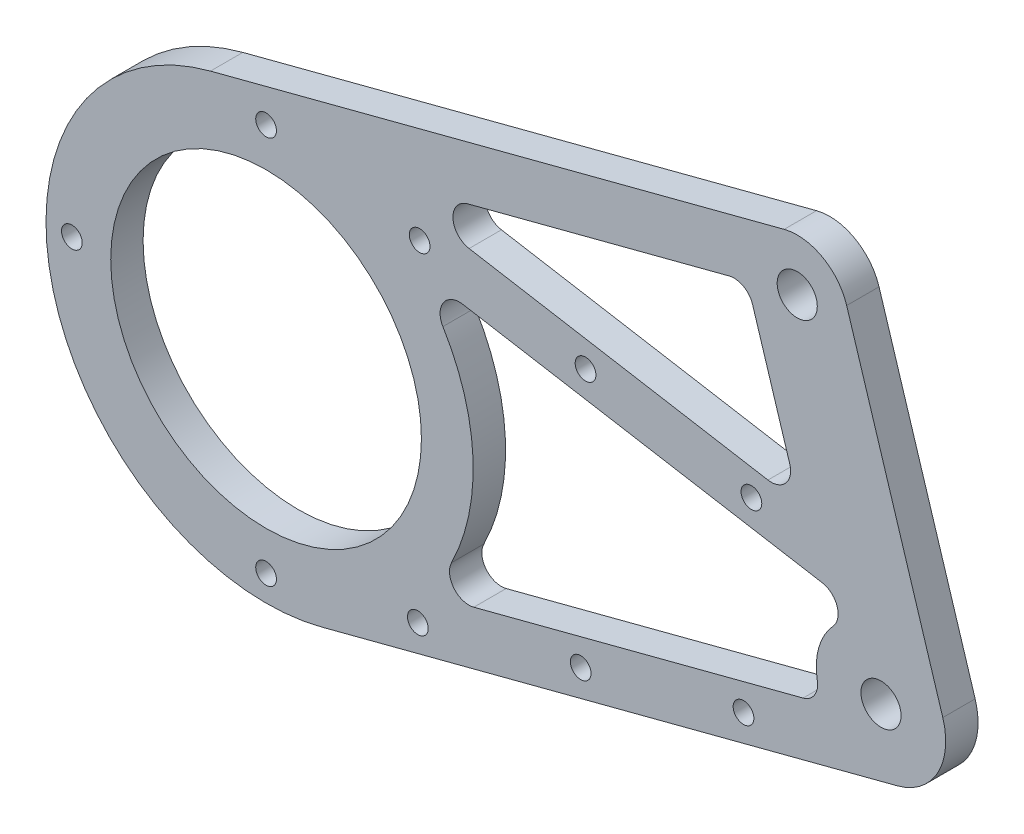
from build123d import *

# Parameters (mm, degrees)
SKETCH_1_R          = 3.1
SKETCH_1_R_2        = 24
EXTRUDE_1_DEPTH     = 5
SKETCH_2_R          = 1.6
CUT_EXTRUDE_1_DEPTH = 44
CUT_EXTRUDE_2_DEPTH = 34
FILLET_1_R          = 3
CUT_EXTRUDE_3_DEPTH = 34
FILLET_2_R          = 3


with BuildPart() as part:
    # 草图1 → 凸台-拉伸1 (new body)
    with BuildSketch(Plane.XY):
        with BuildLine():
            Line((-103.589105886, 32.89722268), (-14.961918346, 56.036814298))
            ThreePointArc((-14.961918346, 56.036814298), (-9.057902271, 55.29071215), (-5.302552139, 50.674282835))
            Line((-5.302552139, 50.674282835), (9.548000145, 2.9724894))
            ThreePointArc((9.548000145, 2.9724894), (8.743053177, -4.853763606), (2.526315789, -9.675625485))
            Line((2.526315789, -9.675625485), (-86.410526316, -32.89712665))
            ThreePointArc((-86.410526316, -32.89712665), (-127.897174666, -8.589289785), (-103.589105886, 32.89722268))
        make_face()
        Circle(SKETCH_1_R, mode=Mode.SUBTRACT)
        with Locations((-95, 0)):
            Circle(SKETCH_1_R_2, mode=Mode.SUBTRACT)
        with Locations((-12.940952255, 48.296291314)):
            Circle(SKETCH_1_R, mode=Mode.SUBTRACT)
    extrude(amount=EXTRUDE_1_DEPTH)

    # 草图2 → 切除-拉伸1 (cut)
    with BuildSketch(Plane(origin=(0, 0, 0), x_dir=(-1, 0, 0), z_dir=(0, 0, -1))):
        with Locations((21.238501013, -11.746543996)):
            Circle(SKETCH_2_R)
        with Locations((46.395127275, -18.314965049)):
            Circle(SKETCH_2_R)
        with Locations((71.551753537, -24.883386101)):
            Circle(SKETCH_2_R)
        with Locations((95, -30)):
            Circle(SKETCH_2_R)
        with Locations((125, 0)):
            Circle(SKETCH_2_R)
        with Locations((95, 30)):
            Circle(SKETCH_2_R)
        with Locations((71.274432107, 26.380963088)):
            Circle(SKETCH_2_R)
        with Locations((45.645838312, 22.002015719)):
            Circle(SKETCH_2_R)
        with Locations((20.017244516, 17.623068351)):
            Circle(SKETCH_2_R)
    extrude(amount=-CUT_EXTRUDE_1_DEPTH, mode=Mode.SUBTRACT)

    # 草图3 → 切除-拉伸2 (cut)
    with BuildSketch(Plane(origin=(0, 0, 0), x_dir=(-1, 0, 0), z_dir=(0, 0, -1))):
        with BuildLine():
            Line((70.381933652, -20.443845267), (8.974874995, -4.410398942))
            ThreePointArc((8.974874995, -4.410398942), (8.011191904, 5.985048394), (-1.684210526, 9.85715146))
            Line((-1.684210526, 9.85715146), (72.232775022, 22.486739799))
            ThreePointArc((72.232775022, 22.486739799), (63.029697498, 1.378317076), (70.381933652, -20.443845267))
        make_face()
    extrude(amount=-CUT_EXTRUDE_2_DEPTH, mode=Mode.SUBTRACT)

    # 圆角1
    fillet_1_edges = [part.edges().sort_by_distance(p)[0] for p in [
        (-8.974874995, -4.410398942, 2.5),
        (1.684210526, 9.85715146, 2.5),
        (-72.232775022, 22.486739799, 2.5),
        (-70.381933652, -20.443845267, 2.5),
    ]]
    fillet(fillet_1_edges, radius=FILLET_1_R)

    # 草图4 → 切除-拉伸3 (cut)
    with BuildSketch(Plane(origin=(0, 0, 0), x_dir=(-1, 0, 0), z_dir=(0, 0, -1))):
        Polygon((20.689823209, 46.27314566), (77.356433109, 31.478112128), (12.641453143, 20.420794919), align=None)
    extrude(amount=-CUT_EXTRUDE_3_DEPTH, mode=Mode.SUBTRACT)

    # 圆角2
    fillet_2_edges = [part.edges().sort_by_distance(p)[0] for p in [
        (-12.641453143, 20.420794919, 2.5),
        (-20.689823209, 46.27314566, 2.5),
        (-77.356433109, 31.478112128, 2.5),
    ]]
    fillet(fillet_2_edges, radius=FILLET_2_R)


solid = part.part
